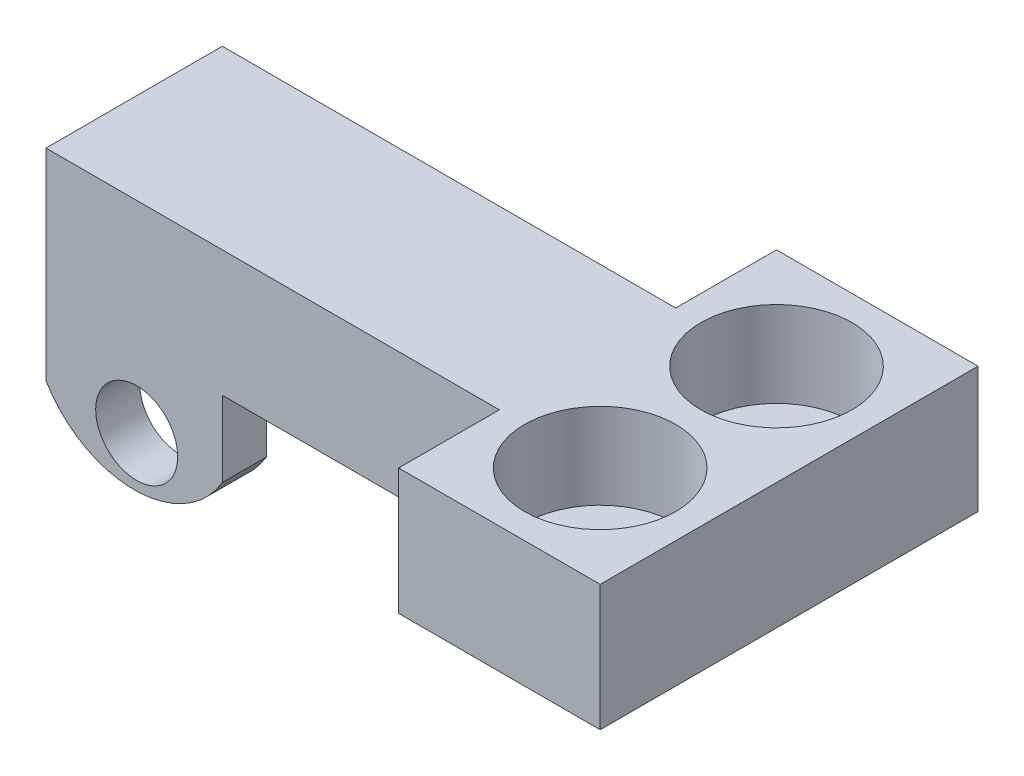
from build123d import *

# Parameters (mm, degrees)
SKETCH_1_R                = 1.628497573
EXTRUDE_1_DEPTH           = 15
SKETCH_2_W                = 7
SKETCH_2_H                = 3.5
CUT_EXTRUDE_1_DEPTH       = 5
CUT_EXTRUDE_4_DEPTH       = 31.430248109
CUT_EXTRUDE_4_DEPTH_BACK  = 31.430248109
SKETCH_5_W                = 18
SKETCH_5_H                = 4
HOLE_WIZARD_1_D           = 3.4
HOLE_WIZARD_1_DEPTH       = 18.5
HOLE_WIZARD_1_CBORE_D     = 6
HOLE_WIZARD_1_CBORE_DEPTH = 3.4
HOLE_WIZARD_1_TIP         = 1.021463052


with BuildPart() as part:
    # 草图1 → 凸台-拉伸1 (new body)
    with BuildSketch(Plane.XY):
        with BuildLine():
            Line((0, 0), (-19, 0))
            Line((-19, 0), (-19, -3))
            ThreePointArc((-19, -3), (-22.5, -5), (-26, -3))
            Line((-26, -3), (-26, 0))
            Line((-26, 0), (-26, 5))
            Line((-26, 5), (0, 5))
            Line((0, 5), (0, 0))
        make_face()
        with Locations((-22.4, -3)):
            Circle(SKETCH_1_R, mode=Mode.SUBTRACT)
    extrude(amount=EXTRUDE_1_DEPTH)

    # 草图2 → 切除-拉伸1 (cut)
    with BuildSketch(Plane.XZ):
        with Locations((-22.5, 7.5)):
            Rectangle(SKETCH_2_W, SKETCH_2_H)
    extrude(amount=CUT_EXTRUDE_1_DEPTH, mode=Mode.SUBTRACT)

    # 草图5 → 切除-拉伸4 (cut, two sides: drawn at the far end of the back side and taken through both)
    with BuildSketch(Plane.XZ.offset(-CUT_EXTRUDE_4_DEPTH_BACK)):
        with Locations((-17, 13)):
            Rectangle(SKETCH_5_W, SKETCH_5_H)
        with Locations((-17, 2)):
            Rectangle(SKETCH_5_W, SKETCH_5_H)
    extrude(amount=CUT_EXTRUDE_4_DEPTH + CUT_EXTRUDE_4_DEPTH_BACK, mode=Mode.SUBTRACT)

    # 打孔尺寸(%根据)内六角圆柱头螺钉的类型1
    with Locations(Plane(origin=(-4, 5, 4), x_dir=(1, 0, 0), z_dir=(0, 1, 0))):
        with Locations((0, 0), (0, -7)):
            CounterBoreHole(HOLE_WIZARD_1_D / 2, HOLE_WIZARD_1_CBORE_D / 2, HOLE_WIZARD_1_CBORE_DEPTH, depth=HOLE_WIZARD_1_DEPTH)
            with Locations((0, 0, -(HOLE_WIZARD_1_DEPTH + HOLE_WIZARD_1_TIP / 2))):  # 118° drill point
                Cone(0, HOLE_WIZARD_1_D / 2, HOLE_WIZARD_1_TIP, mode=Mode.SUBTRACT)


solid = part.part
